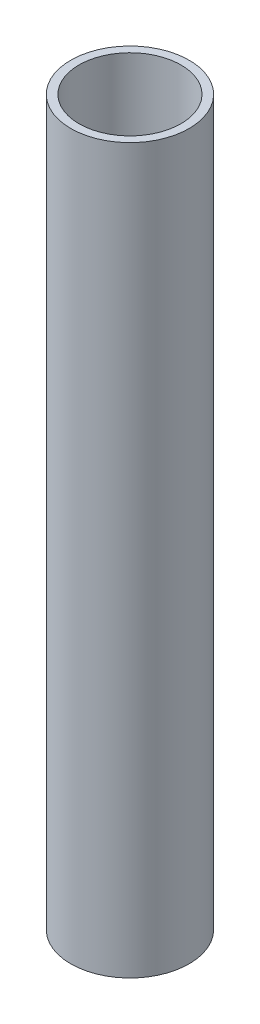
from build123d import *

# Parameters (mm, degrees)
SKETCH1_R           = 9
SKETCH1_R_2         = 7.75
BOSS_EXTRUDE1_DEPTH = 110


with BuildPart() as part:
    # Sketch1 → Boss-Extrude1 (new body)
    with BuildSketch(Plane(origin=(0, 0, 0), x_dir=(1, 0, 0), z_dir=(0, 1, 0))):
        with Locations(Location((0, 0, 0), (0, 0, 270))):
            Circle(SKETCH1_R)
        with Locations(Location((0, 0, 0), (0, 0, 270))):
            Circle(SKETCH1_R_2, mode=Mode.SUBTRACT)
    extrude(amount=BOSS_EXTRUDE1_DEPTH)


solid = part.part
